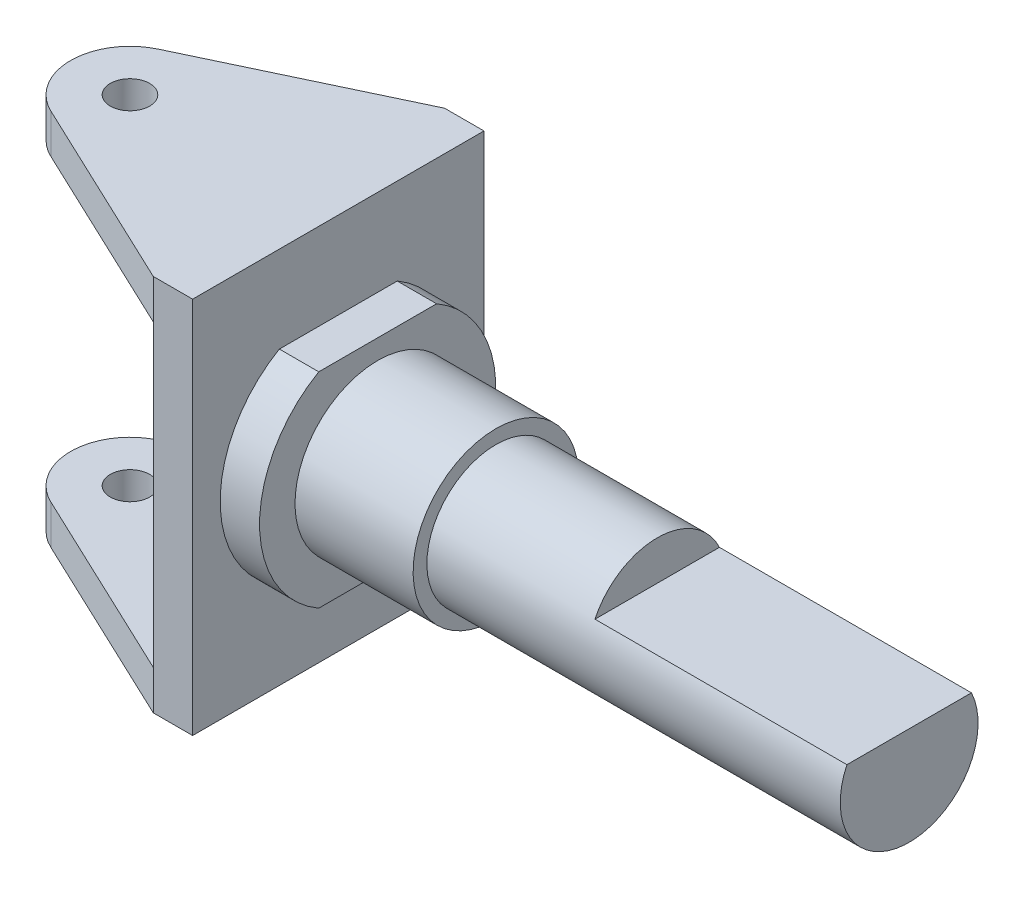
from build123d import *

# Parameters (mm, degrees)
EXTRUDE_THIN1_DEPTH     = 37
CUT_EXTRUDE1_DEPTH      = 119.105884697
CUT_EXTRUDE1_DEPTH_BACK = 119.105884697
SKETCH2_3_R             = 5
CUT_EXTRUDE2_DEPTH      = 119.105884697
BOSS_EXTRUDE1_DEPTH     = 10
SKETCH4_R               = 21
BOSS_EXTRUDE2_DEPTH     = 30
SKETCH5_R               = 17.5
BOSS_EXTRUDE3_DEPTH     = 105
CUT_EXTRUDE3_START      = -64
CUT_EXTRUDE3_DEPTH      = 64


with BuildPart() as part:
    # Sketch1 → Extrude-Thin1 (new, symmetric)
    with BuildSketch(Plane.XY):
        Polygon((-58, -38), (0, -38), (0, 38), (-58, 38), (-58, 48), (10, 48), (10, -48), (-58, -48), align=None)
    extrude(amount=EXTRUDE_THIN1_DEPTH, both=True)

    # Sketch2 → Cut-Extrude1 (cut, two sides: drawn at the far end of the back side and taken through both)
    with BuildSketch(Plane(origin=(0, 48, 0), x_dir=(1, 0, 0), z_dir=(0, 1, 0)).offset(-CUT_EXTRUDE1_DEPTH_BACK)):
        with BuildLine():
            ThreePointArc((-49.370277543, -13.632170103), (-55.661234009, -8.067034306), (-58, 5.3e-08))
            Line((-58, 5.3e-08), (-58, -37))
            Line((-58, -37), (0, -37))
            Line((0, -37), (-49.370277543, -13.632170103))
        make_face()
        with BuildLine():
            Line((-49.370277543, 13.632170103), (0, 37))
            Line((0, 37), (-58, 37))
            Line((-58, 37), (-58, 5.3e-08))
            ThreePointArc((-58, 5.3e-08), (-55.661233981, 8.06703435), (-49.370277543, 13.632170103))
        make_face()
    extrude(amount=CUT_EXTRUDE1_DEPTH + CUT_EXTRUDE1_DEPTH_BACK, mode=Mode.SUBTRACT)

    # Sketch2<3> → Cut-Extrude2 (cut, through all)
    with BuildSketch(Plane(origin=(0, 48, 0), x_dir=(1, 0, 0), z_dir=(0, 1, 0))):
        with Locations((-42.917929128, 0)):
            Circle(SKETCH2_3_R)
    extrude(amount=-CUT_EXTRUDE2_DEPTH, mode=Mode.SUBTRACT)

    # Sketch3 → Boss-Extrude1 (add)
    with BuildSketch(Plane(origin=(10, 0, 0), x_dir=(0, 0, -1), z_dir=(1, 0, 0))):
        with BuildLine():
            Line((-14.966629547, 26), (14.966629547, 26))
            ThreePointArc((14.966629547, 26), (30, 0), (14.966629547, -26))
            Line((14.966629547, -26), (-14.966629547, -26))
            ThreePointArc((-14.966629547, -26), (-30, 0), (-14.966629547, 26))
        make_face()
    extrude(amount=BOSS_EXTRUDE1_DEPTH)

    # Sketch4 → Boss-Extrude2 (add)
    with BuildSketch(Plane(origin=(20, 0, 0), x_dir=(0, 0, -1), z_dir=(1, 0, 0))):
        Circle(SKETCH4_R)
    extrude(amount=BOSS_EXTRUDE2_DEPTH)

    # Sketch5 → Boss-Extrude3 (add)
    with BuildSketch(Plane(origin=(50, 0, 0), x_dir=(0, 0, -1), z_dir=(1, 0, 0))):
        Circle(SKETCH5_R)
    extrude(amount=BOSS_EXTRUDE3_DEPTH)

    # Sketch6 → Cut-Extrude3 (cut)
    with BuildSketch(Plane(origin=(155, 0, 0), x_dir=(0, 0, -1), z_dir=(1, 0, 0)).offset(CUT_EXTRUDE3_START)):
        with BuildLine():
            Line((-15.811388301, 7.5), (15.811388301, 7.5))
            ThreePointArc((15.811388301, 7.5), (0, 17.5), (-15.811388301, 7.5))
        make_face()
    extrude(amount=CUT_EXTRUDE3_DEPTH, mode=Mode.SUBTRACT)


solid = part.part
